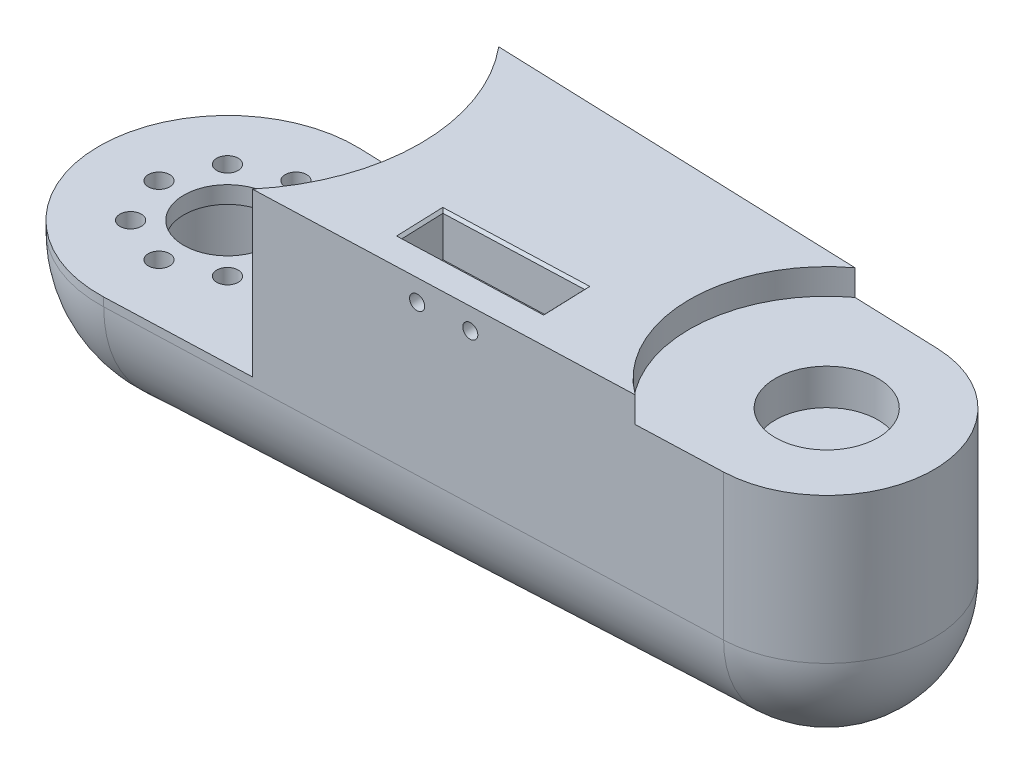
from build123d import *

# Parameters (mm, degrees)
EXTRUDE_1_DEPTH     = 20
REVOLVE_1_ANGLE     = 180
CUT_EXTRUDE_START   = -19
CUT_EXTRUDE_1_DEPTH = 19
SKETCH_5_R          = 10
CUT_EXTRUDE_2_DEPTH = 87.442177205
SKETCH_4_R          = 1.25
SKETCH_4_R_2        = 5.1
CUT_EXTRUDE_3_DEPTH = 86.97819491
CUT_EXTRUDE_START_2 = -3
CUT_EXTRUDE_5_DEPTH = 3
SKETCH_6_R          = 6
CUT_EXTRUDE_4_DEPTH = 4.2
CUT_EXTRUDE_6_DEPTH = 5
HOLE_WIZARD_1_D     = 1.7
HOLE_WIZARD_1_DEPTH = 3.5
CHAMFER_1_SIZE      = 0.3


with BuildPart() as part:
    # 草图2 → 凸台-拉伸1 (new body)
    with BuildSketch(Plane(origin=(0, 0, 0), x_dir=(1, 0, 0), z_dir=(0, 1, 0))):
        with BuildLine():
            Line((70.446428571, 12.492025518), (0.535714286, 14.990430621))
            ThreePointArc((0.535714286, 14.990430621), (-10.415476122, 10.794343757), (-15, 0))
            Line((-15, 0), (82.5, 0))
            ThreePointArc((82.5, 0), (78.995286464, 8.679563435), (70.446428571, 12.492025518))
        make_face()
        with BuildLine():
            Line((82.5, 0), (-15, 0))
            ThreePointArc((-15, 0), (-10.415476122, -10.794343757), (0.535714286, -14.990430621))
            Line((0.535714286, -14.990430621), (70.446428571, -12.492025518))
            ThreePointArc((70.446428571, -12.492025518), (78.995286464, -8.679563435), (82.5, 0))
        make_face()
    extrude(amount=EXTRUDE_1_DEPTH)

    # 草图1 → 旋转1 (revolve)
    with BuildSketch(Plane(origin=(0, 0, 0), x_dir=(1, 0, 0), z_dir=(0, 1, 0))):
        with BuildLine():
            Line((0.535714286, -14.990430621), (70.446428571, -12.492025518))
            ThreePointArc((70.446428571, -12.492025518), (78.995286464, -8.679563435), (82.5, 0))
            Line((82.5, 0), (-15, 0))
            ThreePointArc((-15, 0), (-10.415476122, -10.794343757), (0.535714286, -14.990430621))
        make_face()
    revolve(axis=Axis((70, 0, 0), (1, 0, 0)), revolution_arc=REVOLVE_1_ANGLE)

    # 草图3 → 切除-拉伸1 (cut)
    with BuildSketch(Plane(origin=(0, 20, 0), x_dir=(1, 0, 0), z_dir=(0, 1, 0)).offset(CUT_EXTRUDE_START)):
        with BuildLine():
            Line((17.295525226, 14.391483841), (0.535714286, 14.990430621))
            ThreePointArc((0.535714286, 14.990430621), (-15, 0), (0.535714286, -14.990430621))
            Line((0.535714286, -14.990430621), (17.295525226, -14.391483841))
            ThreePointArc((17.295525226, -14.391483841), (22.5, 0), (17.295525226, 14.391483841))
        make_face()
    extrude(amount=CUT_EXTRUDE_1_DEPTH, mode=Mode.SUBTRACT)

    # 草图5 → 切除-拉伸2 (cut, through all)
    with BuildSketch(Plane(origin=(0, -1, 0), x_dir=(1, 0, 0), z_dir=(0, 1, 0))):
        with Locations(Location((0, 0, 0), (0, 0, 270))):
            Circle(SKETCH_5_R)
    extrude(amount=-CUT_EXTRUDE_2_DEPTH, mode=Mode.SUBTRACT)

    # 草图4 → 切除-拉伸3 (cut, through all)
    with BuildSketch(Plane(origin=(0, 1, 0), x_dir=(1, 0, 0), z_dir=(0, 1, 0))):
        with Locations(Location((8, 0, 0), (0, 0, 270))):
            Circle(SKETCH_4_R)
        with Locations(Location((5.656854249, -5.656854249, 0), (0, 0, 270))):
            Circle(SKETCH_4_R)
        with Locations(Location((0, -8, 0), (0, 0, 270))):
            Circle(SKETCH_4_R)
        with Locations(Location((-5.656854249, -5.656854249, 0), (0, 0, 270))):
            Circle(SKETCH_4_R)
        with Locations(Location((-8, 0, 0), (0, 0, 270))):
            Circle(SKETCH_4_R)
        with Locations(Location((-5.656854249, 5.656854249, 0), (0, 0, 270))):
            Circle(SKETCH_4_R)
        with Locations(Location((0, 8, 0), (0, 0, 270))):
            Circle(SKETCH_4_R)
        with Locations(Location((5.656854249, 5.656854249, 0), (0, 0, 270))):
            Circle(SKETCH_4_R)
        with Locations(Location((0, 0, 0), (0, 0, 270))):
            Circle(SKETCH_4_R_2)
    extrude(amount=-CUT_EXTRUDE_3_DEPTH, mode=Mode.SUBTRACT)

    # 草图11 → 切除-拉伸5 (cut)
    with BuildSketch(Plane(origin=(0, 20, 0), x_dir=(1, 0, 0), z_dir=(0, 1, 0)).offset(CUT_EXTRUDE_START_2)):
        with BuildLine():
            Line((60.465308, 12.848721667), (70.446428571, 12.492025518))
            ThreePointArc((70.446428571, 12.492025518), (82.5, 0), (70.446428571, -12.492025518))
            Line((70.446428571, -12.492025518), (60.465308, -12.848721667))
            ThreePointArc((60.465308, -12.848721667), (54, 0), (60.465308, 12.848721667))
        make_face()
    extrude(amount=CUT_EXTRUDE_5_DEPTH, mode=Mode.SUBTRACT)

    # 草图6 → 切除-拉伸4 (cut)
    with BuildSketch(Plane(origin=(0, 17, 0), x_dir=(1, 0, 0), z_dir=(0, 1, 0))):
        with Locations(Location((70, 0, 0), (0, 0, 270))):
            Circle(SKETCH_6_R)
    extrude(amount=-CUT_EXTRUDE_4_DEPTH, mode=Mode.SUBTRACT)

    # 草图12 → 切除-拉伸6 (cut)
    with BuildSketch(Plane(origin=(0, 20, 0), x_dir=(1, 0, 0), z_dir=(0, 1, 0))):
        Polygon((30.581948853, -5.411239688), (30.760520282, -10.408049895), (38.755416613, -10.122335609), (38.576845185, -5.125525402), align=None)
        Polygon((38.576845185, -5.125525402), (38.755416613, -10.122335609), (46.750312944, -9.836621323), (46.571741516, -4.839811116), align=None)
    extrude(amount=-CUT_EXTRUDE_6_DEPTH, mode=Mode.SUBTRACT)

    # 孔1
    with Locations(Plane(origin=(0.535714286, 0, 14.990430621), x_dir=(0.9993620414023731, 0, -0.035714285714285726), z_dir=(0.035714285714285726, 0, 0.9993620414023731))):
        with Locations((35.369180276, 17.5), (41.369180276, 17.5)):
            Hole(HOLE_WIZARD_1_D / 2, depth=HOLE_WIZARD_1_DEPTH)

    # 倒角1
    chamfer_1_edges = [part.edges().sort_by_distance(p)[0] for p in [
        (38.755416613, 20, 10.122335609),
        (46.66102723, 20, 7.33821622),
        (38.576845185, 20, 5.125525402),
        (30.671234568, 20, 7.909644791),
    ]]
    chamfer(chamfer_1_edges, length=CHAMFER_1_SIZE)


solid = part.part
